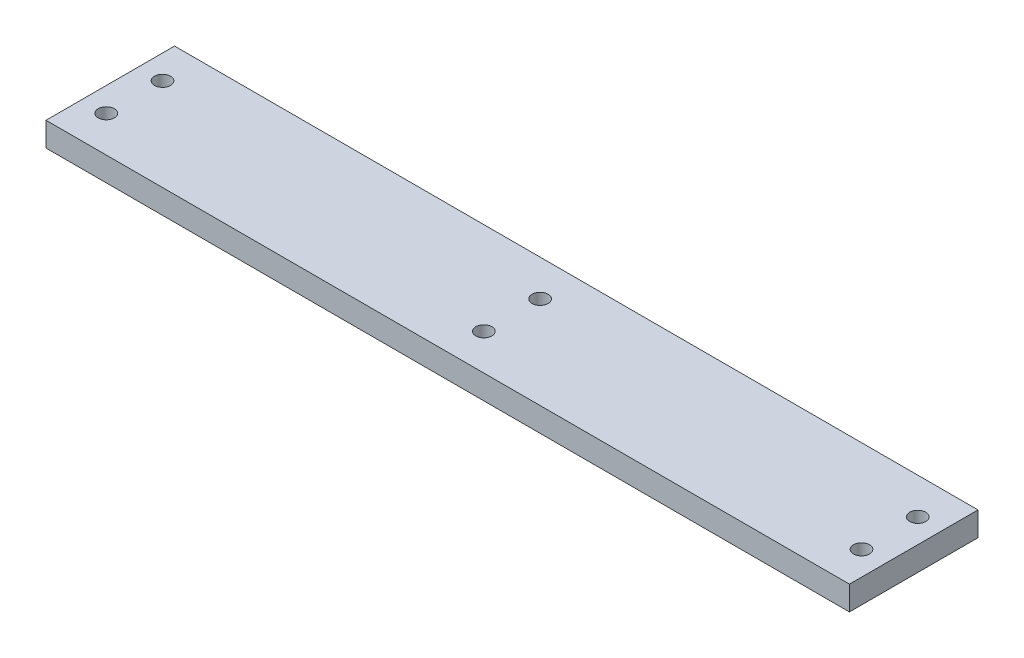
from build123d import *

# Parameters (mm, degrees)
SKETCH_1_W          = 100
SKETCH_1_H          = 16
EXTRUDE_1_DEPTH     = 3
SKETCH_2_R          = 1
CUT_EXTRUDE_1_DEPTH = 3


with BuildPart() as part:
    # 스케치1 → 보스-돌출1 (new body)
    with BuildSketch(Plane(origin=(0, 0, 0), x_dir=(1, 0, 0), z_dir=(0, 1, 0))):
        Rectangle(SKETCH_1_W, SKETCH_1_H)
    extrude(amount=EXTRUDE_1_DEPTH)

    # 스케치2 → 컷-돌출1 (cut)
    with BuildSketch(Plane(origin=(0, 3, 0), x_dir=(1, 0, 0), z_dir=(0, 1, 0))):
        with Locations(Location((47, 3.5, 0), (0, 0, 270))):
            Circle(SKETCH_2_R)
        with Locations(Location((0, 3.5, 0), (0, 0, 270))):
            Circle(SKETCH_2_R)
        with Locations(Location((-47, 3.5, 0), (0, 0, 270))):
            Circle(SKETCH_2_R)
        with Locations(Location((47, -3.5, 0), (0, 0, 90))):
            Circle(SKETCH_2_R)
        with Locations(Location((0, -3.5, 0), (0, 0, 90))):
            Circle(SKETCH_2_R)
        with Locations(Location((-47, -3.5, 0), (0, 0, 90))):
            Circle(SKETCH_2_R)
    extrude(amount=-CUT_EXTRUDE_1_DEPTH, mode=Mode.SUBTRACT)


solid = part.part
